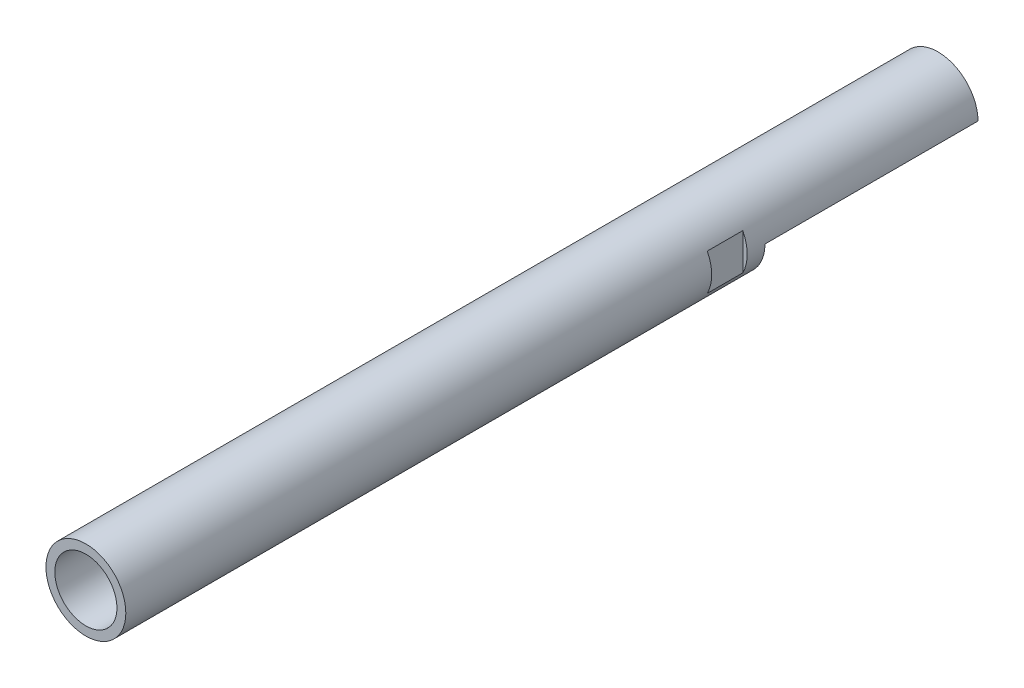
from build123d import *

# Parameters (mm, degrees)
SKETCH1_R                           = 14.2875
SKETCH1_R_2                         = 9.525
BOSS_EXTRUDE1_DEPTH                 = 304.8
SKETCH2_R                           = 11.1125
CUT_EXTRUDE1_DEPTH                  = 19.05
CUT_EXTRUDE4_DEPTH                  = 76.2
CUT_EXTRUDE7_DEPTH                  = 12.7
CUT_EXTRUDE8_REACH                  = 308.326
CUT_EXTRUDE8_END_RADIUS             = 9.525
CUT_EXTRUDE8_DIRECTION_2_REACH      = 308.326
CUT_EXTRUDE8_DIRECTION_2_END_RADIUS = 14.2875


with BuildPart() as part:
    # Sketch1 → Boss-Extrude1 (new body)
    with BuildSketch(Plane.XY):
        with Locations(Location((0, 0, 0), (0, 0, 180))):
            Circle(SKETCH1_R)
        with Locations(Location((0, 0, 0), (0, 0, 180))):
            Circle(SKETCH1_R_2, mode=Mode.SUBTRACT)
    extrude(amount=BOSS_EXTRUDE1_DEPTH)

    # Sketch2 → Cut-Extrude1 (cut)
    with BuildSketch(Plane.XY.offset(304.8)):
        Circle(SKETCH2_R)
    extrude(amount=-CUT_EXTRUDE1_DEPTH, mode=Mode.SUBTRACT)

    # Sketch6 → Cut-Extrude4 (cut)
    with BuildSketch(Plane(origin=(0, 0, 0), x_dir=(-1, 0, 0), z_dir=(0, 0, -1))):
        with BuildLine():
            Line((14.2875, 0), (-14.2875, 0))
            ThreePointArc((-14.2875, 0), (0, -14.2875), (14.2875, 0))
        make_face()
    extrude(amount=-CUT_EXTRUDE4_DEPTH, mode=Mode.SUBTRACT)

    # Sketch8 → Cut-Extrude7 (cut)
    with BuildSketch(Plane(origin=(0, 0, 82.55), x_dir=(-1, 0, 0), z_dir=(0, 0, -1))):
        with BuildLine():
            ThreePointArc((-6.545430181, -12.7), (0, -14.2875), (6.545430181, -12.7))
            Line((6.545430181, -12.7), (-6.545430181, -12.7))
        make_face()
        with BuildLine():
            Line((-12.7, -6.545430181), (-12.7, 6.545430181))
            ThreePointArc((-12.7, 6.545430181), (-14.2875, 0), (-12.7, -6.545430181))
        make_face()
    extrude(amount=-CUT_EXTRUDE7_DEPTH, mode=Mode.SUBTRACT)

    # Cut-Extrude8: up to this cylinder (the profile starts outside it)
    cut_extrude8_end = Plane(origin=(0, 0, 158.75), z_dir=(0, 0, -1)) * Cylinder(CUT_EXTRUDE8_END_RADIUS, 636.702, mode=Mode.PRIVATE)
    # Sketch9 → Cut-Extrude8 (cut, up to the surface)
    with BuildSketch(Plane.XZ.offset(12.7), mode=Mode.PRIVATE) as cut_extrude8_sk1:
        with BuildLine():
            ThreePointArc((0, 161.925), (-3.175, 158.75), (0, 155.575))
            Line((0, 155.575), (0, 161.925))
        make_face()
    cut_extrude8_tool1 = extrude(cut_extrude8_sk1.sketch, amount=-CUT_EXTRUDE8_REACH, mode=Mode.PRIVATE) - cut_extrude8_end
    add(cut_extrude8_tool1.solids().sort_by_distance((-1.347512, -12.7, 158.75))[0], mode=Mode.SUBTRACT)
    # Sketch9 → Cut-Extrude8 (cut, up to the surface)
    with BuildSketch(Plane.XZ.offset(12.7), mode=Mode.PRIVATE) as cut_extrude8_sk2:
        with BuildLine():
            Line((0, 161.925), (0, 155.575))
            ThreePointArc((0, 155.575), (2.24506403, 156.50493597), (3.175, 158.75))
            ThreePointArc((3.175, 158.75), (2.24506403, 160.99506403), (0, 161.925))
        make_face()
    cut_extrude8_tool2 = extrude(cut_extrude8_sk2.sketch, amount=-CUT_EXTRUDE8_REACH, mode=Mode.PRIVATE) - cut_extrude8_end
    add(cut_extrude8_tool2.solids().sort_by_distance((1.347512, -12.7, 158.75))[0], mode=Mode.SUBTRACT)
    # Sketch9 → Cut-Extrude8 (cut, up to the surface)
    with BuildSketch(Plane.XZ.offset(12.7), mode=Mode.PRIVATE) as cut_extrude8_sk3:
        with BuildLine():
            ThreePointArc((0, 161.925), (-3.175, 158.75), (0, 155.575))
            Line((0, 155.575), (0, 161.925))
        make_face()
    cut_extrude8_tool3 = extrude(cut_extrude8_sk3.sketch, amount=-CUT_EXTRUDE8_REACH, mode=Mode.PRIVATE) - cut_extrude8_end
    add(cut_extrude8_tool3.solids().sort_by_distance((-1.347512, -12.7, 158.75))[0], mode=Mode.SUBTRACT)
    # Sketch9 → Cut-Extrude8 (cut, up to the surface)
    with BuildSketch(Plane.XZ.offset(12.7), mode=Mode.PRIVATE) as cut_extrude8_sk4:
        with BuildLine():
            Line((0, 161.925), (0, 155.575))
            ThreePointArc((0, 155.575), (2.24506403, 156.50493597), (3.175, 158.75))
            ThreePointArc((3.175, 158.75), (2.24506403, 160.99506403), (0, 161.925))
        make_face()
    cut_extrude8_tool4 = extrude(cut_extrude8_sk4.sketch, amount=-CUT_EXTRUDE8_REACH, mode=Mode.PRIVATE) - cut_extrude8_end
    add(cut_extrude8_tool4.solids().sort_by_distance((1.347512, -12.7, 158.75))[0], mode=Mode.SUBTRACT)

    # Cut-Extrude8 direction 2: up to this cylinder (the profile starts inside it)
    cut_extrude8_direction_2_end = Plane(origin=(0, 0, 158.75), z_dir=(0, 0, -1)) * Cylinder(CUT_EXTRUDE8_DIRECTION_2_END_RADIUS, 646.227, mode=Mode.PRIVATE)
    # Sketch9 → Cut-Extrude8 direction 2 (cut, up to the surface)
    with BuildSketch(Plane.XZ.offset(12.7), mode=Mode.PRIVATE) as cut_extrude8_direction_2_sk1:
        with BuildLine():
            ThreePointArc((0, 161.925), (-3.175, 158.75), (0, 155.575))
            Line((0, 155.575), (0, 161.925))
        make_face()
    cut_extrude8_direction_2_tool1 = extrude(cut_extrude8_direction_2_sk1.sketch, amount=CUT_EXTRUDE8_DIRECTION_2_REACH, mode=Mode.PRIVATE) & cut_extrude8_direction_2_end
    add(cut_extrude8_direction_2_tool1.solids().sort_by_distance((-1.347512, -12.7, 158.75))[0], mode=Mode.SUBTRACT)
    # Sketch9 → Cut-Extrude8 direction 2 (cut, up to the surface)
    with BuildSketch(Plane.XZ.offset(12.7), mode=Mode.PRIVATE) as cut_extrude8_direction_2_sk2:
        with BuildLine():
            Line((0, 161.925), (0, 155.575))
            ThreePointArc((0, 155.575), (2.24506403, 156.50493597), (3.175, 158.75))
            ThreePointArc((3.175, 158.75), (2.24506403, 160.99506403), (0, 161.925))
        make_face()
    cut_extrude8_direction_2_tool2 = extrude(cut_extrude8_direction_2_sk2.sketch, amount=CUT_EXTRUDE8_DIRECTION_2_REACH, mode=Mode.PRIVATE) & cut_extrude8_direction_2_end
    add(cut_extrude8_direction_2_tool2.solids().sort_by_distance((1.347512, -12.7, 158.75))[0], mode=Mode.SUBTRACT)
    # Sketch9 → Cut-Extrude8 direction 2 (cut, up to the surface)
    with BuildSketch(Plane.XZ.offset(12.7), mode=Mode.PRIVATE) as cut_extrude8_direction_2_sk3:
        with BuildLine():
            ThreePointArc((0, 161.925), (-3.175, 158.75), (0, 155.575))
            Line((0, 155.575), (0, 161.925))
        make_face()
    cut_extrude8_direction_2_tool3 = extrude(cut_extrude8_direction_2_sk3.sketch, amount=CUT_EXTRUDE8_DIRECTION_2_REACH, mode=Mode.PRIVATE) & cut_extrude8_direction_2_end
    add(cut_extrude8_direction_2_tool3.solids().sort_by_distance((-1.347512, -12.7, 158.75))[0], mode=Mode.SUBTRACT)
    # Sketch9 → Cut-Extrude8 direction 2 (cut, up to the surface)
    with BuildSketch(Plane.XZ.offset(12.7), mode=Mode.PRIVATE) as cut_extrude8_direction_2_sk4:
        with BuildLine():
            Line((0, 161.925), (0, 155.575))
            ThreePointArc((0, 155.575), (2.24506403, 156.50493597), (3.175, 158.75))
            ThreePointArc((3.175, 158.75), (2.24506403, 160.99506403), (0, 161.925))
        make_face()
    cut_extrude8_direction_2_tool4 = extrude(cut_extrude8_direction_2_sk4.sketch, amount=CUT_EXTRUDE8_DIRECTION_2_REACH, mode=Mode.PRIVATE) & cut_extrude8_direction_2_end
    add(cut_extrude8_direction_2_tool4.solids().sort_by_distance((1.347512, -12.7, 158.75))[0], mode=Mode.SUBTRACT)


solid = part.part
